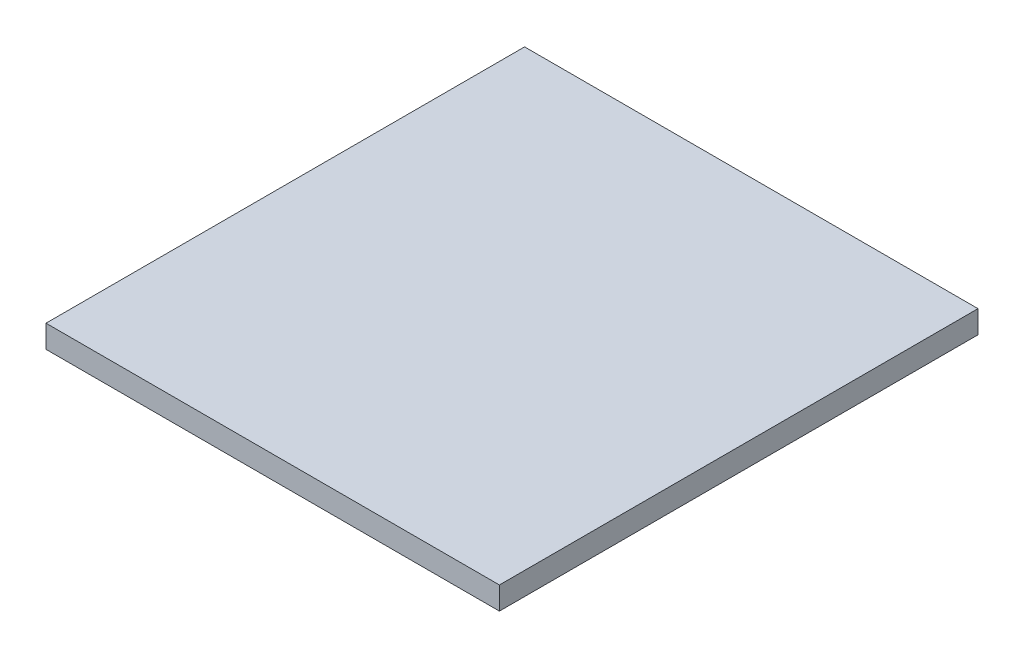
from build123d import *

# Parameters (mm, degrees)
CROQUIS1_W              = 360
CROQUIS1_H              = 380
SALIENTE_EXTRUIR1_DEPTH = 18


with BuildPart() as part:
    # Croquis1 → Saliente-Extruir1 (new body)
    with BuildSketch(Plane(origin=(0, 0, 0), x_dir=(1, 0, 0), z_dir=(0, 1, 0))):
        Rectangle(CROQUIS1_W, CROQUIS1_H)
    extrude(amount=SALIENTE_EXTRUIR1_DEPTH)


solid = part.part
